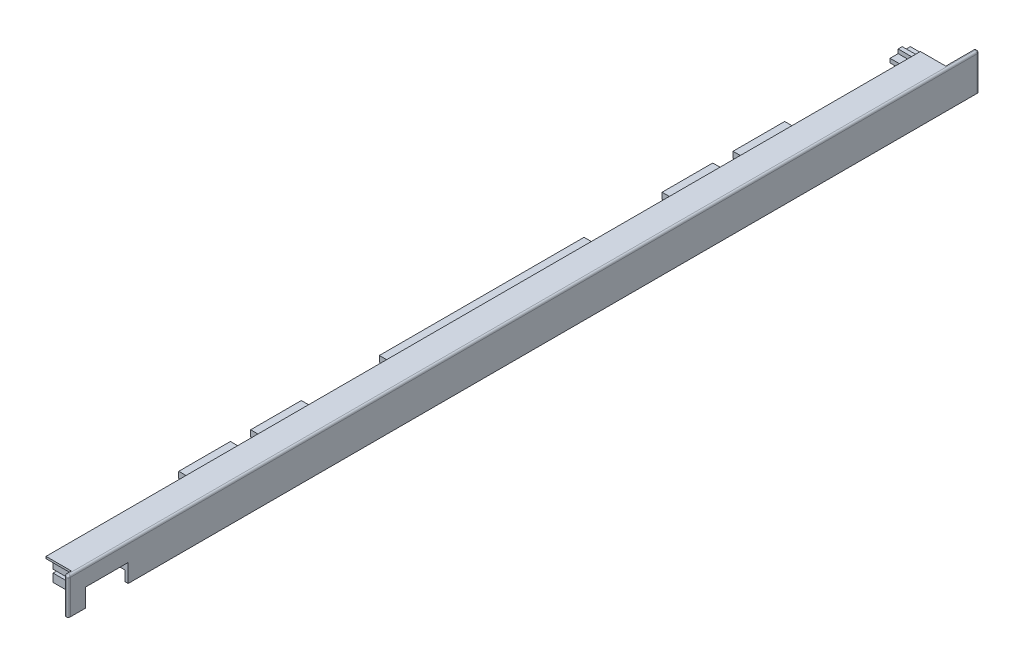
from build123d import *

# Parameters (mm, degrees)
EXTRUDE_1_DEPTH          = 449.532
SKETCH_7_W               = 15
SKETCH_7_H               = 12.9
CUT_EXTRUDE_2_DEPTH      = 12.5
CUT_EXTRUDE_3_DEPTH      = 12.5
SKETCH_10_W              = 25.5
SKETCH_10_H              = 3
SKETCH_10_W_2            = 101
SKETCH_10_W_3            = 25
EXTRUDE_6_DEPTH          = 30
CUT_EXTRUDE_4_DEPTH      = 30
CUT_EXTRUDE_4_DEPTH_BACK = 30
SKETCH_11_W              = 21
SKETCH_11_H              = 9
SKETCH_12_W              = 30
SKETCH_12_H              = 4
CUT_EXTRUDE_5_DEPTH      = 12.5
SKETCH_15_W              = 7
SKETCH_15_H              = 2
CUT_EXTRUDE_8_DEPTH      = 12.5
SKETCH_17_W              = 20
SKETCH_17_H              = 2.5
CUT_EXTRUDE_9_DEPTH      = 12.5
FILLET_2_R               = 1
FILLET_3_R               = 1
FILLET_4_R               = 1


with BuildPart() as part:
    # 草图1 → 凸台-拉伸1 (new body)
    with BuildSketch(Plane.XY):
        Polygon((0, 0), (-14, 0), (-14, -1), (-1.5, -1), (-1.5, -3.55), (-14, -3.55), (-14, -7.25), (-1.5, -7.25), (-1.5, -8.9), (-14, -8.9), (-14, -12.9), (-1.5, -12.9), (-1.5, -17.9), (0, -17.9), align=None)
    extrude(amount=EXTRUDE_1_DEPTH)

    # 草图7 → 切除-拉伸2 (cut)
    with BuildSketch(Plane.ZY.offset(14)):
        with Locations((7.5, -6.45)):
            Rectangle(SKETCH_7_W, SKETCH_7_H)
    extrude(amount=-CUT_EXTRUDE_2_DEPTH, mode=Mode.SUBTRACT)

    # 草图8 → 切除-拉伸3 (cut)
    with BuildSketch(Plane.ZY.offset(14)):
        Polygon((449.532, -12.9), (443.032, -12.9), (443.032, -1), (446.532, -1.000447275), (446.532, 0), (449.532, 0), align=None)
    extrude(amount=-CUT_EXTRUDE_3_DEPTH, mode=Mode.SUBTRACT)

    # 草图10 → 凸台-拉伸6 (add)
    with BuildSketch(Plane.ZY.offset(1.5)):
        Polygon((6.5, -14.9), (6.5, -16.9), (8.5, -16.9), (8.5, -14.9), (12.5, -14.9), (12.5, -12.9), (8.5, -12.9), (8.5, -10.9), (6.5, -10.9), (6.5, -12.9), (2.5, -12.9), (2.5, -14.9), align=None)
        with Locations((77.25, -15.4)):
            Rectangle(SKETCH_10_W, SKETCH_10_H)
        with Locations((214.017, -15.4)):
            Rectangle(SKETCH_10_W_2, SKETCH_10_H)
        with Locations((112.5, -15.4)):
            Rectangle(SKETCH_10_W_3, SKETCH_10_H)
        with Locations((315.532, -15.4)):
            Rectangle(SKETCH_10_W_3, SKETCH_10_H)
        with Locations((350.782, -15.4)):
            Rectangle(SKETCH_10_W, SKETCH_10_H)
    extrude(amount=EXTRUDE_6_DEPTH)

    # 草图11 → 切除-拉伸4 (cut, two sides: drawn at the far end of the back side and taken through both)
    with BuildSketch(Plane.ZY.offset(1.5).offset(-CUT_EXTRUDE_4_DEPTH_BACK)):
        with Locations((430.4789, -13.4)):
            Rectangle(SKETCH_11_W, SKETCH_11_H)
    extrude(amount=CUT_EXTRUDE_4_DEPTH + CUT_EXTRUDE_4_DEPTH_BACK, mode=Mode.SUBTRACT)

    # 草图12 → 切除-拉伸5 (cut)
    with BuildSketch(Plane.ZY.offset(14)):
        with Locations((399.0289, -10.9)):
            Rectangle(SKETCH_12_W, SKETCH_12_H)
    extrude(amount=-CUT_EXTRUDE_5_DEPTH, mode=Mode.SUBTRACT)

    # 草图15 → 切除-拉伸8 (cut)
    with BuildSketch(Plane.ZY.offset(14)):
        with Locations((34.5, -9.9)):
            Rectangle(SKETCH_15_W, SKETCH_15_H)
    extrude(amount=-CUT_EXTRUDE_8_DEPTH, mode=Mode.SUBTRACT)

    # 草图17 → 切除-拉伸9 (cut)
    with BuildSketch(Plane.ZY.offset(14)):
        with Locations((67, -10.15)):
            Rectangle(SKETCH_17_W, SKETCH_17_H)
    extrude(amount=-CUT_EXTRUDE_9_DEPTH, mode=Mode.SUBTRACT)

    # 圆角2
    fillet_2_edges = [part.edges().sort_by_distance(p)[0] for p in [
        (0, 0, 224.766),
    ]]
    fillet(fillet_2_edges, radius=FILLET_2_R)

    # 圆角3
    fillet_3_edges = [part.edges().sort_by_distance(p)[0] for p in [
        (0, -9.45, 0),
        (-1.25, 0, 0),
        (-0.292893219, -0.292893219, 0),
    ]]
    fillet(fillet_3_edges, radius=FILLET_3_R)

    # 圆角4
    fillet_4_edges = [part.edges().sort_by_distance(p)[0] for p in [
        (-1.25, 0, 449.532),
        (-0.292893219, -0.292893219, 449.532),
        (0, -9.45, 449.532),
    ]]
    fillet(fillet_4_edges, radius=FILLET_4_R)


solid = part.part
